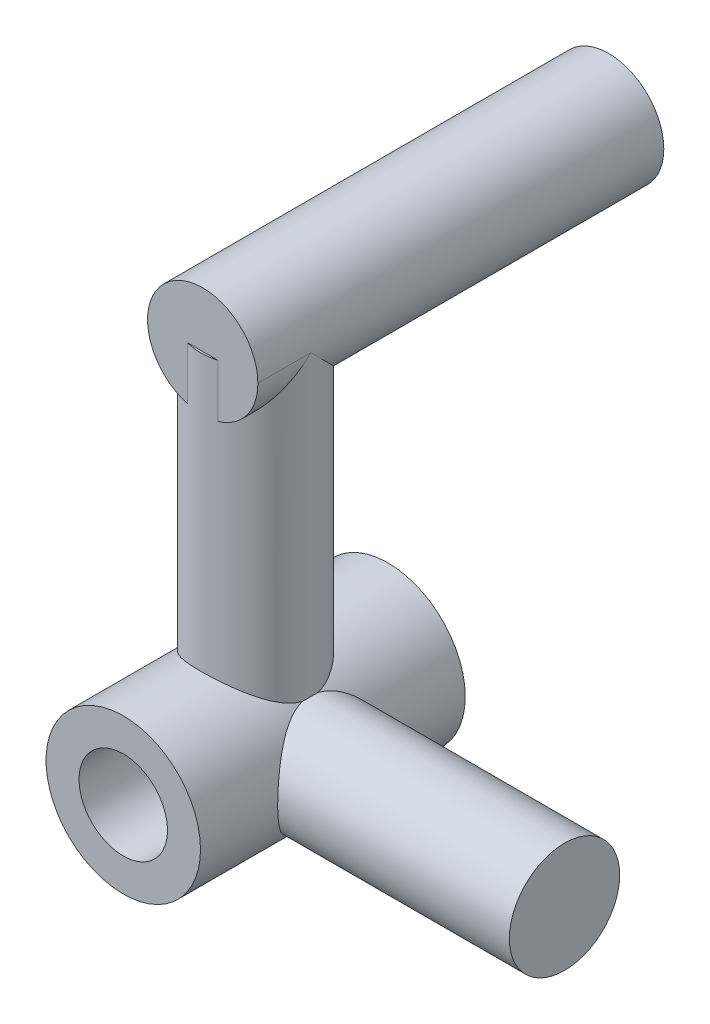
from build123d import *
from build123d.topology import SkipClean

# Parameters (mm, degrees)
SKETCH1_R           = 1.75
SKETCH1_R_2         = 1
BOSS_EXTRUDE1_DEPTH = 3
SKETCH4_R           = 1.25
BOSS_EXTRUDE2_DEPTH = 7
SKETCH5_R           = 1.002291121
CUT_EXTRUDE1_DEPTH  = 10.384162347
SKETCH6_R           = 1.25
BOSS_EXTRUDE3_DEPTH = 8
SKETCH7_R           = 1.25
BOSS_EXTRUDE4_DEPTH = 8
BOSS_EXTRUDE5_START = 1.2
SKETCH8_R           = 1.25
BOSS_EXTRUDE5_DEPTH = 1.2


with BuildPart() as part:
    # Sketch1 → Boss-Extrude1 (new, symmetric)
    with BuildSketch(Plane.XY):
        Circle(SKETCH1_R)
        Circle(SKETCH1_R_2, mode=Mode.SUBTRACT)
    extrude(amount=BOSS_EXTRUDE1_DEPTH, both=True)

    # Sketch4 → Boss-Extrude2 (add)
    with BuildSketch(Plane(origin=(0, 0, 0), x_dir=(0, 0, -1), z_dir=(1, 0, 0))):
        Circle(SKETCH4_R)
    extrude(amount=BOSS_EXTRUDE2_DEPTH)

    # Sketch5 → Cut-Extrude1 (cut, through all)
    with BuildSketch(Plane.XY.offset(3)):
        Circle(SKETCH5_R)
    extrude(amount=-CUT_EXTRUDE1_DEPTH, mode=Mode.SUBTRACT)

    # Sketch6 → Boss-Extrude3 (add)
    with BuildSketch(Plane(origin=(0, 0, 0), x_dir=(1, 0, 0), z_dir=(0, 1, 0))):
        with Locations(Location((0, 0, 0), (0, 0, 8.130102354))):
            Circle(SKETCH6_R)
    extrude(amount=BOSS_EXTRUDE3_DEPTH)

    # Sketch7 → Boss-Extrude4 (add)
    with BuildSketch(Plane.XY):
        with Locations((0, 8)):
            Circle(SKETCH7_R)
    extrude(amount=-BOSS_EXTRUDE4_DEPTH)

    # Sketch8 → Boss-Extrude5 (add)
    with SkipClean():  # the faces are left unmerged after this step: merging them gives an invalid solid
        with BuildSketch(Plane.XY.offset(BOSS_EXTRUDE5_START)):
            with Locations((0, 8)):
                Circle(SKETCH8_R)
        extrude(amount=-BOSS_EXTRUDE5_DEPTH)


solid = part.part
